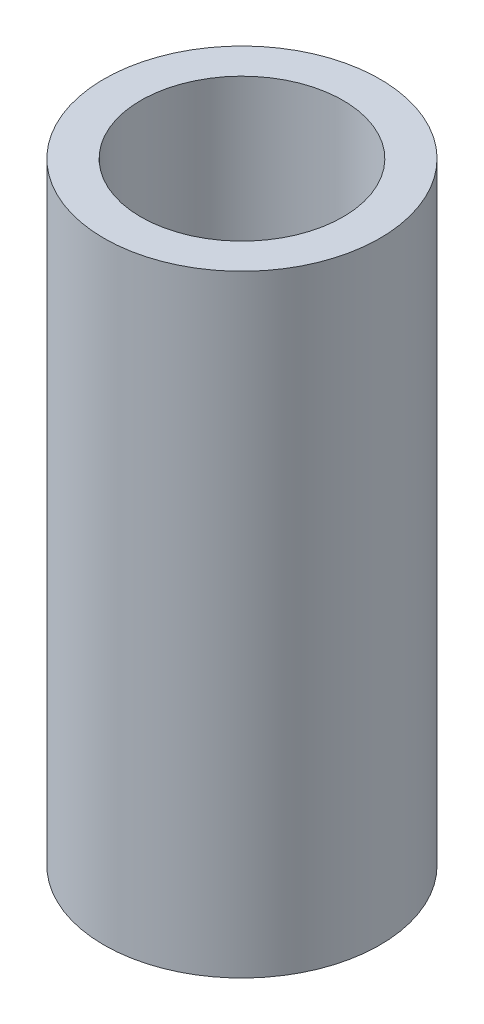
from build123d import *

# Parameters (mm, degrees)
SKETCH1_R           = 0.45085
SKETCH1_R_2         = 0.3302
BOSS_EXTRUDE1_DEPTH = 2


with BuildPart() as part:
    # Sketch1 → Boss-Extrude1 (new body)
    with BuildSketch(Plane(origin=(0, 0, 0), x_dir=(1, 0, 0), z_dir=(0, 1, 0))):
        with Locations(Location((0, 0, 0), (0, 0, 270))):
            Circle(SKETCH1_R)
        with Locations(Location((0, 0, 0), (0, 0, 270))):
            Circle(SKETCH1_R_2, mode=Mode.SUBTRACT)
    extrude(amount=BOSS_EXTRUDE1_DEPTH)


solid = part.part
